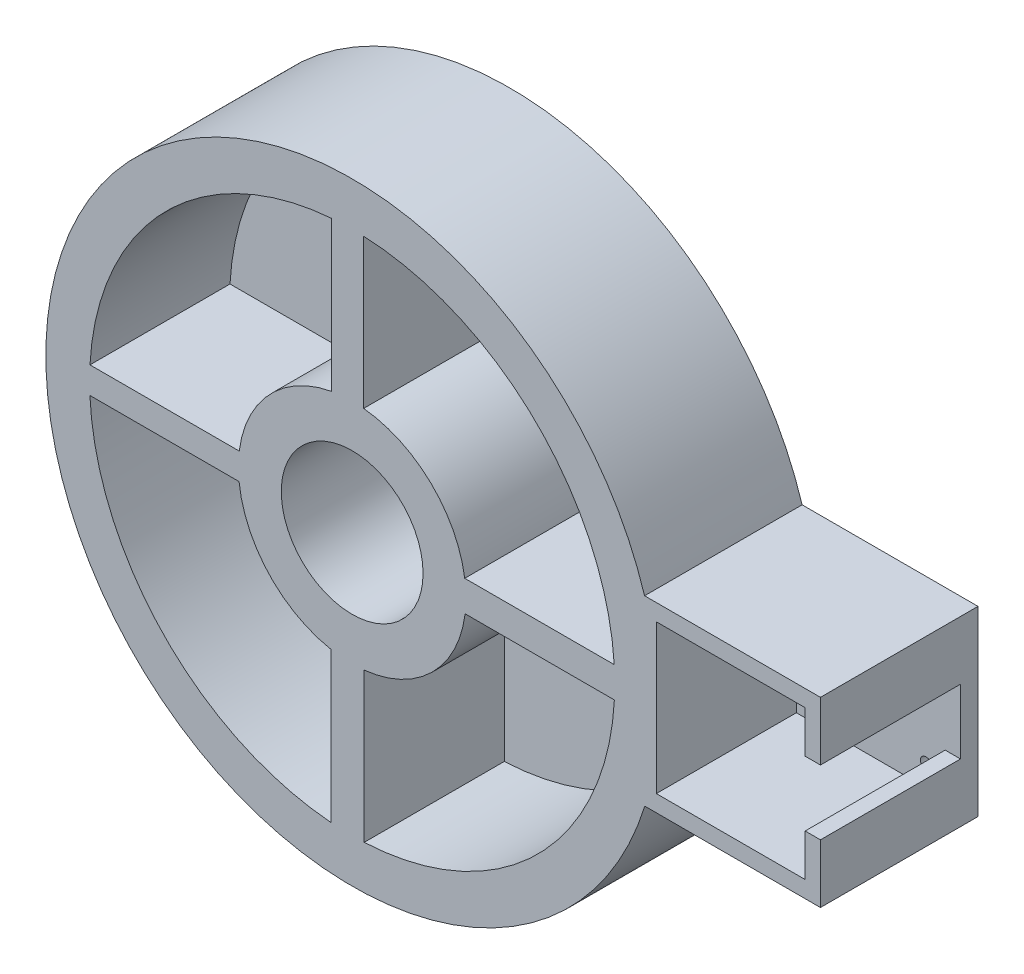
from build123d import *

# Parameters (mm, degrees)
SKETCH1_R           = 20
BOSS_EXTRUDE4_DEPTH = 40
BOSS_EXTRUDE5_START = 5
BOSS_EXTRUDE5_DEPTH = 5
SKETCH6_R           = 1.25
CUT_EXTRUDE1_DEPTH  = 5
SKETCH7_R           = 3
CUT_EXTRUDE2_DEPTH  = 2
SKETCH8_R           = 20.25
CUT_EXTRUDE3_DEPTH  = 40
SKETCH9_W           = 42.5
SKETCH9_H           = 42.5
CUT_EXTRUDE4_DEPTH  = 40
SKETCH10_W          = 18.5
SKETCH10_H          = 40
CUT_EXTRUDE5_DEPTH  = 7
SKETCH11_R          = 1.6
CUT_EXTRUDE6_DEPTH  = 269.248997311


with BuildPart() as part:
    # Sketch1 → Boss-Extrude4 (new body)
    with BuildSketch(Plane(origin=(0, 0, 0), x_dir=(0, 1, 0), z_dir=(0, 0, 1))):
        with BuildLine():
            Line((48.86109499, -159.669791534), (48.86109499, -209.83599005))
            Line((48.86109499, -209.83599005), (65.86109499, -209.83599005))
            Line((65.86109499, -209.83599005), (65.86109499, -204.83599005))
            Line((65.86109499, -204.83599005), (53.86109499, -204.83599005))
            Line((53.86109499, -204.83599005), (53.86109499, -163.588668859))
            Line((53.86109499, -163.588668859), (95.86109499, -163.588668859))
            Line((95.86109499, -163.588668859), (95.86109499, -204.83599005))
            Line((95.86109499, -204.83599005), (83.86109499, -204.83599005))
            Line((83.86109499, -204.83599005), (83.86109499, -209.83599005))
            Line((83.86109499, -209.83599005), (100.86109499, -209.83599005))
            Line((100.86109499, -209.83599005), (100.86109499, -159.603176712))
            ThreePointArc((100.86109499, -159.603176712), (74.64197355, 11.411259343), (48.86109499, -159.669791534))
        make_face()
        with Locations(Location((74.754065705, -76.088668859, 0), (0, 0, 270))):
            Circle(SKETCH1_R, mode=Mode.SUBTRACT)
        with BuildLine():
            Line((149.524530838, -70.225432227), (106.720805548, -70.225432227))
            ThreePointArc((106.720805548, -70.225432227), (97.065220712, -52.456860586), (78.771338454, -43.837908873))
            Line((78.771338454, -43.837908873), (78.771338454, -1.19633601))
            ThreePointArc((78.771338454, -1.19633601), (127.128973259, -22.405626297), (149.524530838, -70.225432227))
        make_face(mode=Mode.SUBTRACT)
        with BuildLine():
            Line((149.682278397, -79.369361301), (107.088057991, -79.369361301))
            ThreePointArc((107.088057991, -79.369361301), (98.250620194, -98.542219295), (79.498497507, -108.240501884))
            Line((79.498497507, -108.240501884), (79.498497507, -150.938454209))
            ThreePointArc((79.498497507, -150.938454209), (128.302794309, -128.600892817), (149.682278397, -79.369361301))
        make_face(mode=Mode.SUBTRACT)
        with BuildLine():
            Line((70.783231418, -150.983478259), (70.783231418, -108.345179443))
            ThreePointArc((70.783231418, -108.345179443), (51.584378521, -98.879359849), (42.436457903, -79.52701525))
            Line((42.436457903, -79.52701525), (-0.167078, -79.52701525))
            ThreePointArc((-0.167078, -79.52701525), (21.532899104, -128.932849482), (70.783231418, -150.983478259))
        make_face(mode=Mode.SUBTRACT)
        with BuildLine():
            Line((-0.003869503, -70.067778277), (42.816644448, -70.067778277))
            ThreePointArc((42.816644448, -70.067778277), (52.673264417, -52.241484236), (71.203948876, -43.783148116))
            Line((71.203948876, -43.783148116), (71.203948876, -1.172738174))
            ThreePointArc((71.203948876, -1.172738174), (22.603616127, -22.187550051), (-0.003869503, -70.067778277))
        make_face(mode=Mode.SUBTRACT)
    extrude(amount=BOSS_EXTRUDE4_DEPTH)

    # Sketch4 → Boss-Extrude5 (add)
    with BuildSketch(Plane(origin=(0, 0, 0), x_dir=(1, 0, 0), z_dir=(0, 0, -1)).offset(BOSS_EXTRUDE5_START)):
        with BuildLine():
            Line((159.669791534, -48.86109499), (209.83599005, -48.86109499))
            Line((209.83599005, -48.86109499), (209.83599005, -100.86109499))
            Line((209.83599005, -100.86109499), (159.603176712, -100.86109499))
            ThreePointArc((159.603176712, -100.86109499), (-11.411259343, -74.64197355), (159.669791534, -48.86109499))
        make_face()
    extrude(amount=-BOSS_EXTRUDE5_DEPTH)

    # Sketch6 → Cut-Extrude1 (cut)
    with BuildSketch(Plane(origin=(0, 0, -5), x_dir=(1, 0, 0), z_dir=(0, 0, -1))):
        with Locations(Location((199.962329455, -59.61109499, 0), (0, 0, 180))):
            Circle(SKETCH6_R)
        with Locations(Location((168.962329455, -59.61109499, 0), (0, 0, 180))):
            Circle(SKETCH6_R)
        with Locations(Location((168.962329455, -90.61109499, 0), (0, 0, 180))):
            Circle(SKETCH6_R)
        with Locations(Location((199.962329455, -90.61109499, 0), (0, 0, 180))):
            Circle(SKETCH6_R)
    extrude(amount=-CUT_EXTRUDE1_DEPTH, mode=Mode.SUBTRACT)

    # Sketch7 → Cut-Extrude2 (cut)
    with BuildSketch(Plane(origin=(0, 0, -5), x_dir=(-1, 0, 0), z_dir=(0, 0, -1))):
        with Locations((-199.962329455, 59.61109499)):
            Circle(SKETCH7_R)
        with Locations((-168.962329455, 59.61109499)):
            Circle(SKETCH7_R)
        with Locations((-168.962329455, 90.61109499)):
            Circle(SKETCH7_R)
        with Locations((-199.962329455, 90.61109499)):
            Circle(SKETCH7_R)
    extrude(amount=-CUT_EXTRUDE2_DEPTH, mode=Mode.SUBTRACT)

    # Sketch8 → Cut-Extrude3 (cut)
    with BuildSketch(Plane.XY.offset(40)):
        with Locations((76.088668859, 74.754065705)):
            Circle(SKETCH8_R)
    extrude(amount=-CUT_EXTRUDE3_DEPTH, mode=Mode.SUBTRACT)

    # Sketch9 → Cut-Extrude4 (cut)
    with BuildSketch(Plane.XY.offset(40)):
        with Locations((184.212329455, 74.86109499)):
            Rectangle(SKETCH9_W, SKETCH9_H)
    extrude(amount=-CUT_EXTRUDE4_DEPTH, mode=Mode.SUBTRACT)

    # Sketch10 → Cut-Extrude5 (cut)
    with BuildSketch(Plane.YZ.offset(209.83599005)):
        with Locations((74.86109499, 20)):
            Rectangle(SKETCH10_W, SKETCH10_H)
    extrude(amount=-CUT_EXTRUDE5_DEPTH, mode=Mode.SUBTRACT)

    # Sketch11 → Cut-Extrude6 (cut, through all)
    with BuildSketch(Plane.XY):
        with Locations((168.962329455, 90.61109499)):
            Circle(SKETCH11_R)
        with Locations((199.962329455, 90.61109499)):
            Circle(SKETCH11_R)
        with Locations((168.962329455, 59.61109499)):
            Circle(SKETCH11_R)
        with Locations((199.962329455, 59.61109499)):
            Circle(SKETCH11_R)
    extrude(amount=-CUT_EXTRUDE6_DEPTH, mode=Mode.SUBTRACT)


solid = part.part
